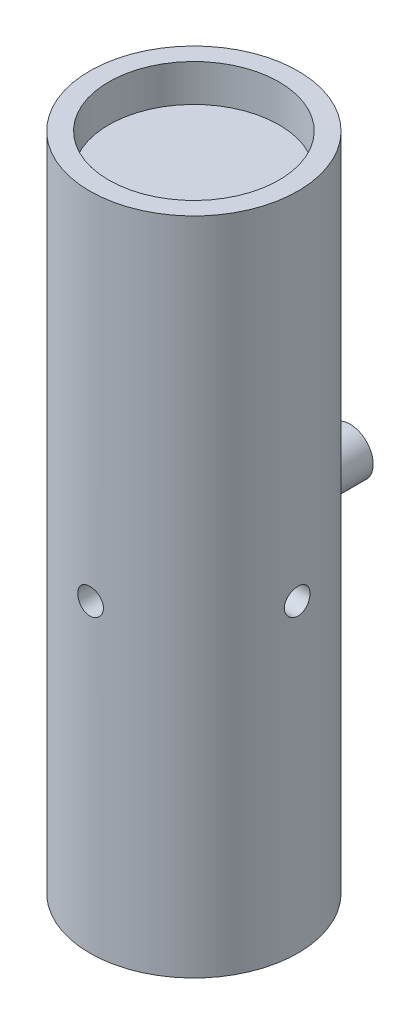
from build123d import *

# Parameters (mm, degrees)
SKETCH1_R                 = 14
EXTRUDE1_DEPTH            = 88.76
M4X0_7_TAPPED_HOLE1_D     = 3.3
M4X0_7_TAPPED_HOLE1_DEPTH = 5.029
M4X0_7_TAPPED_HOLE1_TIP   = 0.991420021
CIRPATTERN1_COUNT         = 3
CIRPATTERN1_ANGLE         = 180
SKETCH6_R                 = 11.447205948
EXTRUDE2_DEPTH            = 5
EXTRUDE3_DEPTH            = 1
EXTRUDE3_DEPTH_BACK       = 7
SKETCH7_R                 = 3.118608258


with BuildPart() as part:
    # Sketch1 → Extrude1 (new body)
    with BuildSketch(Plane(origin=(0, 0, 0), x_dir=(1, 0, 0), z_dir=(0, 1, 0))):
        Circle(SKETCH1_R)
    extrude(amount=EXTRUDE1_DEPTH)

    # M4x0.7 Tapped Hole1
    with Locations(Plane(origin=(-1.120603621, 0, -3.903834828), x_dir=(-1, 0, 0), z_dir=(0, -1, 0))):
        with Locations((-1.120603621, -3.903834828)):
            Hole(M4X0_7_TAPPED_HOLE1_D / 2, depth=M4X0_7_TAPPED_HOLE1_DEPTH)
            with Locations((0, 0, -(M4X0_7_TAPPED_HOLE1_DEPTH + M4X0_7_TAPPED_HOLE1_TIP / 2))):  # 118° drill point
                Cone(0, M4X0_7_TAPPED_HOLE1_D / 2, M4X0_7_TAPPED_HOLE1_TIP, mode=Mode.SUBTRACT)

    # Sketch4 → #8-32 Tapped Hole1 (revolve, cut)
    with BuildSketch(Plane(origin=(-14, 41, 0), x_dir=(0, 0, 1), z_dir=(0, 1, 0))):
        Polygon((0, 0), (0, 11.745806461), (1.7272, 10.708), (1.7272, 0), align=None)
    f_8_32_tapped_hole1 = revolve(axis=Axis((-20.35, 41, 0), (1, 0, 0)), mode=Mode.SUBTRACT)

    # CirPattern1: #8-32 Tapped Hole1 ×3 about axis
    cirpattern1_axis = Axis((0, 0, 0), (0, 1, 0))
    for i in range(1, CIRPATTERN1_COUNT):
        add(f_8_32_tapped_hole1.rotate(cirpattern1_axis, i * CIRPATTERN1_ANGLE / (CIRPATTERN1_COUNT - 1)), mode=Mode.SUBTRACT)

    # Sketch6 → Extrude2 (cut)
    with BuildSketch(Plane(origin=(0, 88.76, 0), x_dir=(1, 0, 0), z_dir=(0, 1, 0))):
        Circle(SKETCH6_R)
    extrude(amount=-EXTRUDE2_DEPTH, mode=Mode.SUBTRACT)

    # Sketch7 → Extrude3 (add, two sides: drawn at the far end of the back side and taken through both)
    with BuildSketch(Plane.XY.offset(-14).offset(-EXTRUDE3_DEPTH_BACK)):
        with Locations((0, 41)):
            Circle(SKETCH7_R)
    extrude(amount=EXTRUDE3_DEPTH + EXTRUDE3_DEPTH_BACK)


solid = part.part
